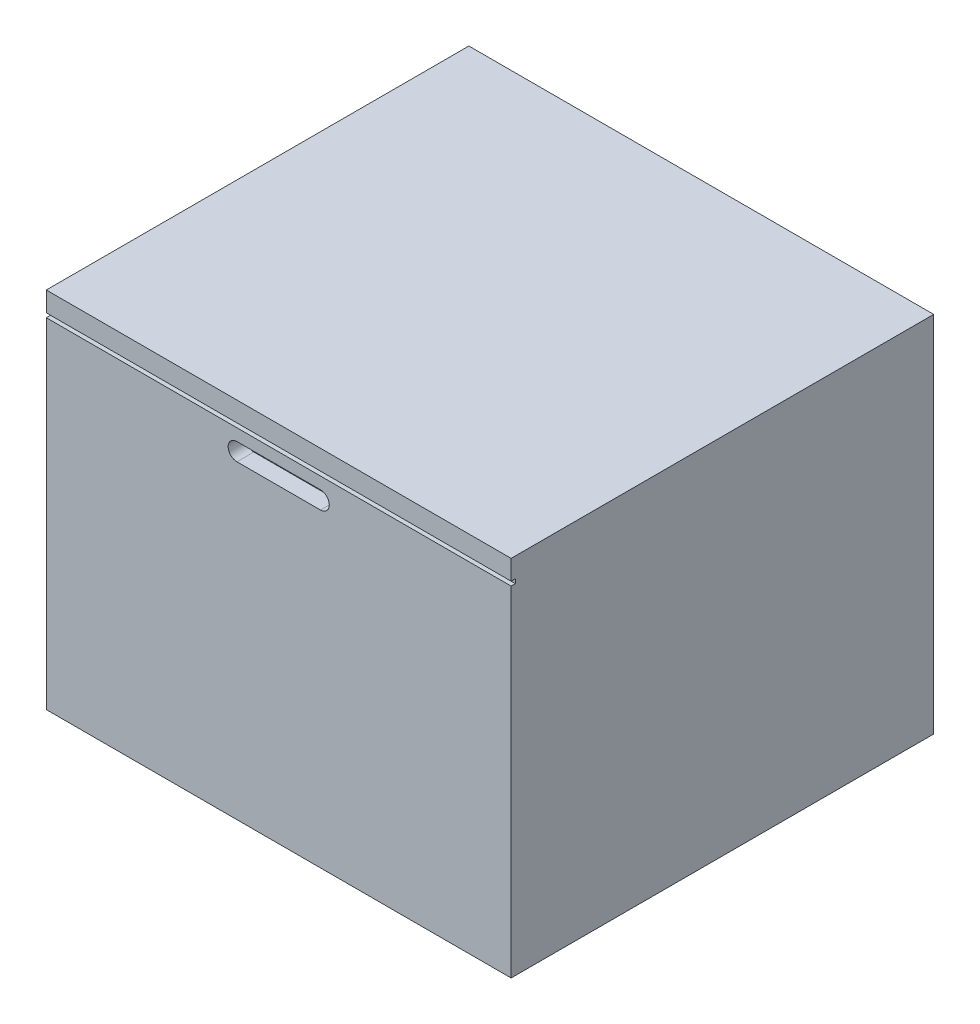
from build123d import *

# Parameters (mm, degrees)
SKETCH1_W           = 550
SKETCH1_H           = 500
BOSS_EXTRUDE1_DEPTH = 430
CUT_EXTRUDE1_DEPTH  = 20
SKETCH3_W           = 550
SKETCH3_H           = 5
CUT_EXTRUDE2_DEPTH  = 5


with BuildPart() as part:
    # Sketch1 → Boss-Extrude1 (new body)
    with BuildSketch(Plane(origin=(0, 0, 0), x_dir=(1, 0, 0), z_dir=(0, 1, 0))):
        Rectangle(SKETCH1_W, SKETCH1_H)
    extrude(amount=BOSS_EXTRUDE1_DEPTH)

    # Sketch2 → Cut-Extrude1 (cut)
    with BuildSketch(Plane.XY.offset(250)):
        with BuildLine():
            Line((-49.448842032, 387.477048559), (49.448842032, 387.477048559))
            ThreePointArc((49.448842032, 387.477048559), (59.819797821, 377.10609277), (49.448842032, 366.735136981))
            Line((49.448842032, 366.735136981), (-49.448842032, 366.735136981))
            ThreePointArc((-49.448842032, 366.735136981), (-59.819797821, 377.10609277), (-49.448842032, 387.477048559))
        make_face()
    extrude(amount=-CUT_EXTRUDE1_DEPTH, mode=Mode.SUBTRACT)

    # Sketch3 → Cut-Extrude2 (cut)
    with BuildSketch(Plane.XY.offset(250)):
        with Locations((0, 404.090827498)):
            Rectangle(SKETCH3_W, SKETCH3_H)
    extrude(amount=-CUT_EXTRUDE2_DEPTH, mode=Mode.SUBTRACT)


solid = part.part
